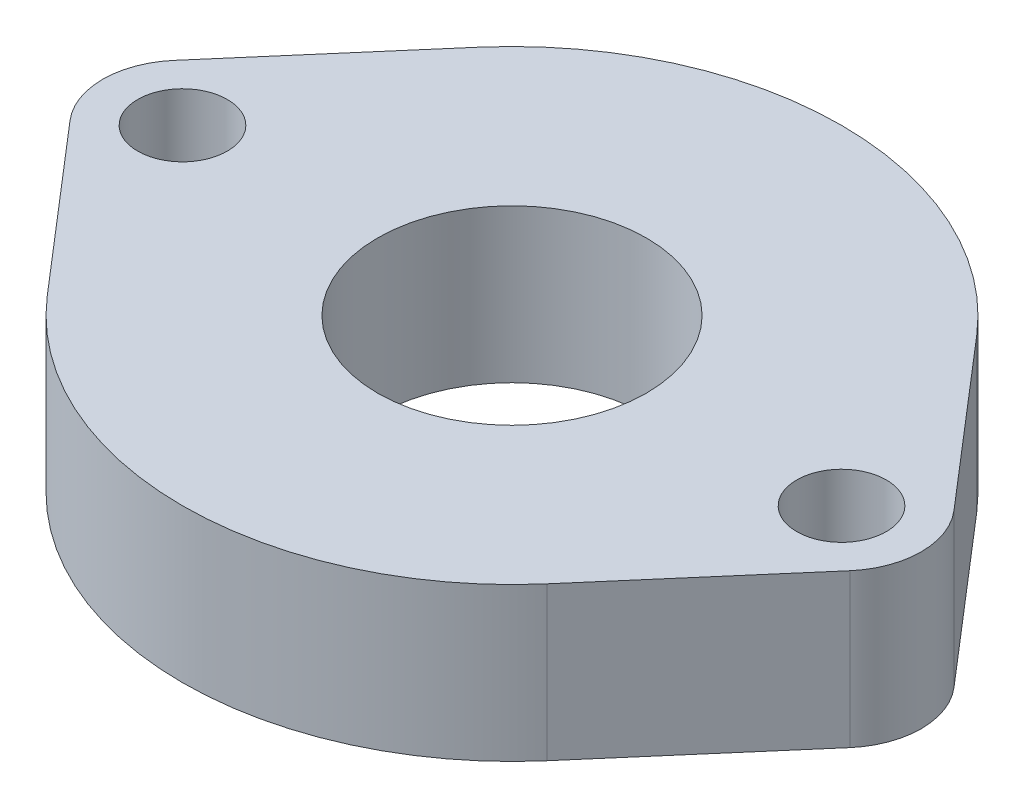
from build123d import *

# Parameters (mm, degrees)
SKETCH1_R           = 1.7272
BOSS_EXTRUDE1_DEPTH = 5.9055
SKETCH6_R           = 5.1816
CUT_EXTRUDE4_DEPTH  = 22.094195358


with BuildPart() as part:
    # Sketch1 → Boss-Extrude1 (new body)
    with BuildSketch(Plane(origin=(0, 0, 0), x_dir=(1, 0, 0), z_dir=(0, 1, 0))):
        with BuildLine():
            Line((-15.0296372, 2.004639139), (-9.6266, 8.283632805))
            ThreePointArc((-9.6266, 8.283632805), (0, 12.7), (9.6266, 8.283632805))
            Line((9.6266, 8.283632805), (15.0296372, 2.004639139))
            ThreePointArc((15.0296372, 2.004639139), (15.7734, 0), (15.0296372, -2.004639139))
            Line((15.0296372, -2.004639139), (9.6266, -8.283632805))
            ThreePointArc((9.6266, -8.283632805), (0, -12.7), (-9.6266, -8.283632805))
            Line((-9.6266, -8.283632805), (-15.0296372, -2.004639139))
            ThreePointArc((-15.0296372, -2.004639139), (-15.7734, 0), (-15.0296372, 2.004639139))
        make_face()
        with Locations(Location((-12.7, 0, 0), (0, 0, 270))):
            Circle(SKETCH1_R, mode=Mode.SUBTRACT)
        with Locations(Location((12.7, 0, 0), (0, 0, 270))):
            Circle(SKETCH1_R, mode=Mode.SUBTRACT)
    extrude(amount=BOSS_EXTRUDE1_DEPTH)

    # Sketch6 → Cut-Extrude4 (cut, through all)
    with BuildSketch(Plane(origin=(0, 5.9055, 0), x_dir=(1, 0, 0), z_dir=(0, 1, 0))):
        with Locations(Location((0, 0, 0), (0, 0, 270))):
            Circle(SKETCH6_R)
    extrude(amount=-CUT_EXTRUDE4_DEPTH, mode=Mode.SUBTRACT)


solid = part.part
